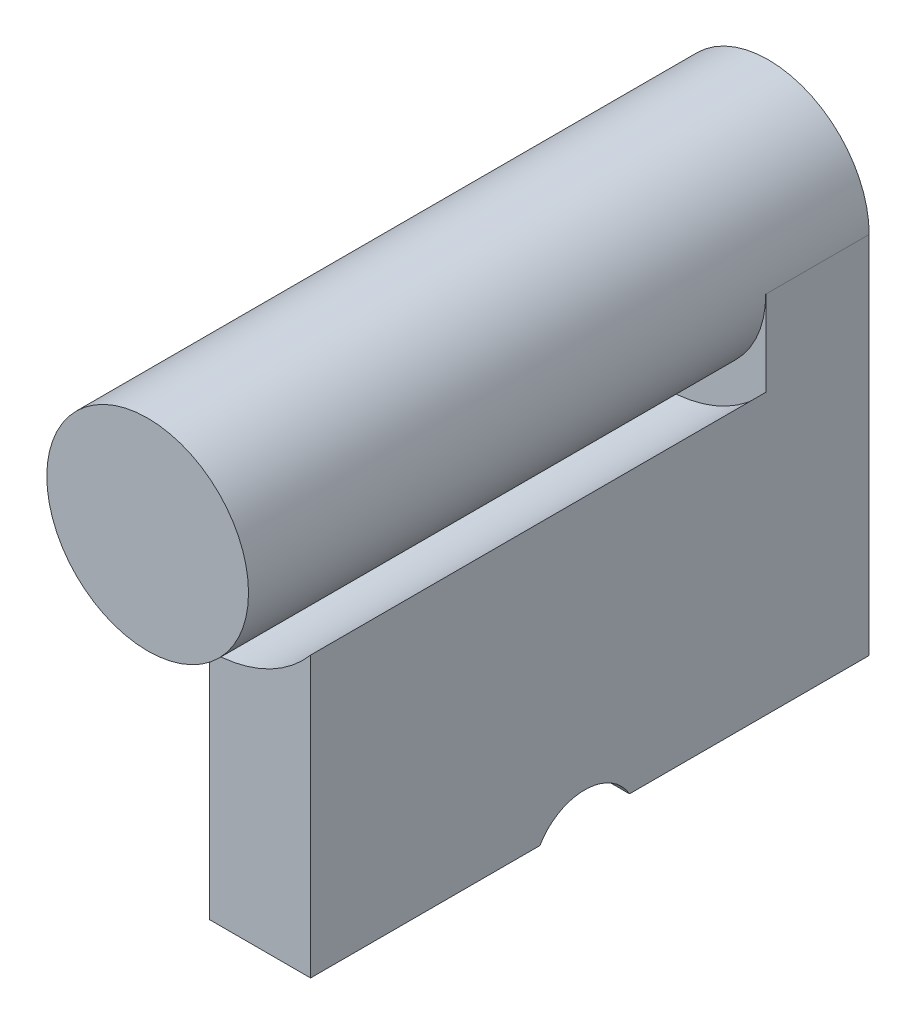
from build123d import *

# Parameters (mm, degrees)
SKETCH_1_R          = 1.95
EXTRUDE_1_DEPTH     = 12
SKETCH_4_W          = 2
SKETCH_4_H          = 9
EXTRUDE_2_DEPTH     = 1.95
EXTRUDE_4_DEPTH     = 8.8
SKETCH_9_R          = 1
CUT_EXTRUDE_2_DEPTH = 17
SKETCH_13_R         = 1.375
CUT_EXTRUDE_6_DEPTH = 1
CUT_EXTRUDE_7_DEPTH = 13.389713
SCALE_1_SCALE       = 2


with BuildPart() as part:
    # 스케치1 → 보스-돌출1 (new body)
    with BuildSketch(Plane.XY):
        Circle(SKETCH_1_R)
    extrude(amount=EXTRUDE_1_DEPTH)

    # 스케치4 → 보스-돌출2 (add)
    with BuildSketch(Plane(origin=(0, 0, 0), x_dir=(0, 0, -1), z_dir=(1, 0, 0))):
        with Locations((-1, -2.55)):
            Rectangle(SKETCH_4_W, SKETCH_4_H)
    extrude(amount=EXTRUDE_2_DEPTH)

    # 스케치8 → 보스-돌출4 (add)
    with BuildSketch(Plane.XY.offset(2)):
        with BuildLine():
            ThreePointArc((1.95, -1.643168), (1.075273, -2.312204), (0, -2.55))
            Line((0, -2.55), (0, -7.05))
            Line((0, -7.05), (1.95, -7.05))
            Line((1.95, -7.05), (1.95, -1.643168))
        make_face()
    extrude(amount=EXTRUDE_4_DEPTH)

    # 스케치9 → 컷-돌출2 (cut)
    with BuildSketch(Plane.ZY):
        with Locations((5.5, -7.55)):
            Circle(SKETCH_9_R)
    extrude(amount=-CUT_EXTRUDE_2_DEPTH, mode=Mode.SUBTRACT)

    # 스케치13 → 컷-돌출6 (cut)
    with BuildSketch(Plane.ZY):
        with Locations((5.505014, -7.55)):
            Circle(SKETCH_13_R)
    extrude(amount=-CUT_EXTRUDE_6_DEPTH, mode=Mode.SUBTRACT)

    # 스케치12 → 컷-돌출7 (cut, through all)
    with BuildSketch(Plane.XY.offset(2)):
        with BuildLine():
            Line((1.95, 0), (1.95, 1.95))
            Line((1.95, 1.95), (0, 1.95))
            ThreePointArc((0, 1.95), (1.378858, 1.378858), (1.95, 0))
        make_face()
    extrude(amount=-CUT_EXTRUDE_7_DEPTH, mode=Mode.SUBTRACT)


with BuildPart() as part_1:
    # 축척1: scaled about (0, 0, 0)
    add(part.part.scale(SCALE_1_SCALE))


solid = part_1.part
